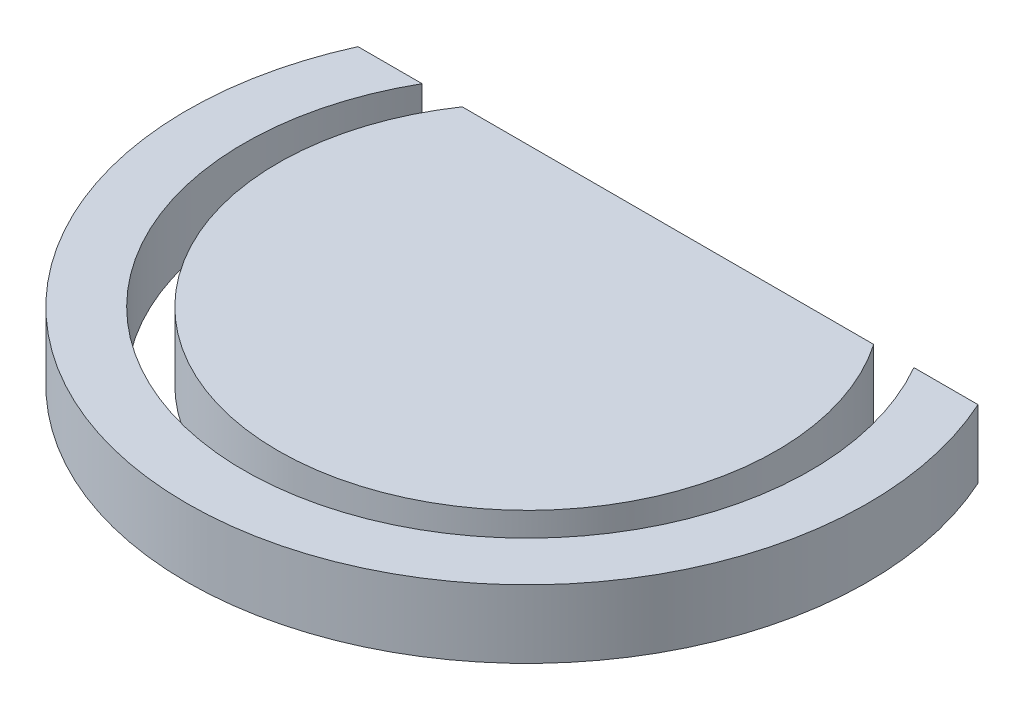
from build123d import *

# Parameters (mm, degrees)
AUFSATZ_LINEAR_AUSTRAGEN1_DEPTH   = 10
AUFSATZ_LINEAR_AUSTRAGEN1_2_DEPTH = 10


with BuildPart() as part:
    # Skizze1 → Aufsatz-Linear austragen1 (new body)
    with BuildSketch(Plane(origin=(0, 0, 0), x_dir=(1, 0, 0), z_dir=(0, 1, 0))):
        with BuildLine():
            ThreePointArc((-30.217844449, 20.664627908), (0, -36.607990518), (30.217844449, 20.664627908))
            Line((30.217844449, 20.664627908), (-30.217844449, 20.664627908))
        make_face()
    extrude(amount=AUFSATZ_LINEAR_AUSTRAGEN1_DEPTH)


with BuildPart() as body_2:
    # Skizze1 → Aufsatz-Linear austragen1 2 (new body)
    with BuildSketch(Plane(origin=(0, 0, 0), x_dir=(1, 0, 0), z_dir=(0, 1, 0))):
        with BuildLine():
            ThreePointArc((-45.529914929, 20.664627908), (0, -50), (45.529914929, 20.664627908))
            Line((45.529914929, 20.664627908), (36.11368201, 20.664627908))
            ThreePointArc((36.11368201, 20.664627908), (0, -41.607990518), (-36.11368201, 20.664627908))
            Line((-36.11368201, 20.664627908), (-45.529914929, 20.664627908))
        make_face()
    extrude(amount=AUFSATZ_LINEAR_AUSTRAGEN1_2_DEPTH)


solid = Compound([part.part, body_2.part])
